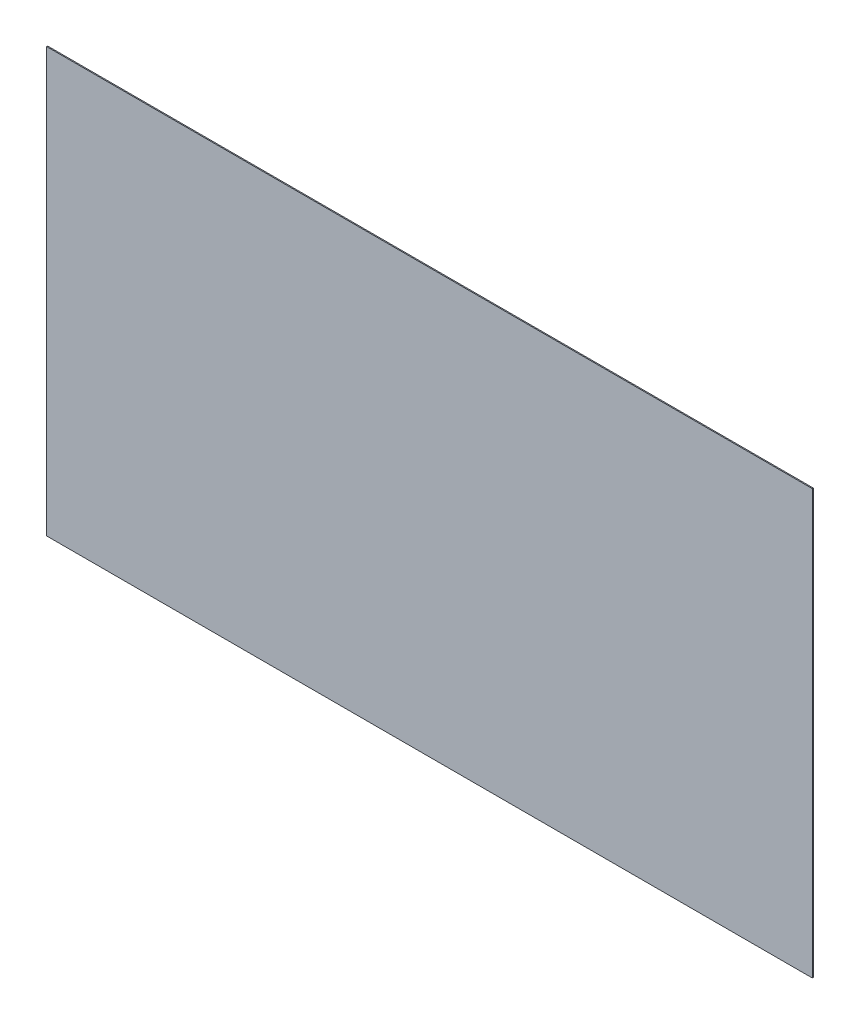
from build123d import *

# Parameters (mm, degrees)
SKETCH1_W           = 1120
SKETCH1_H           = 620
BOSS_EXTRUDE1_DEPTH = 1.5


with BuildPart() as part:
    # Sketch1 → Boss-Extrude1 (new body)
    with BuildSketch(Plane.XY):
        Rectangle(SKETCH1_W, SKETCH1_H)
    extrude(amount=BOSS_EXTRUDE1_DEPTH)


solid = part.part
